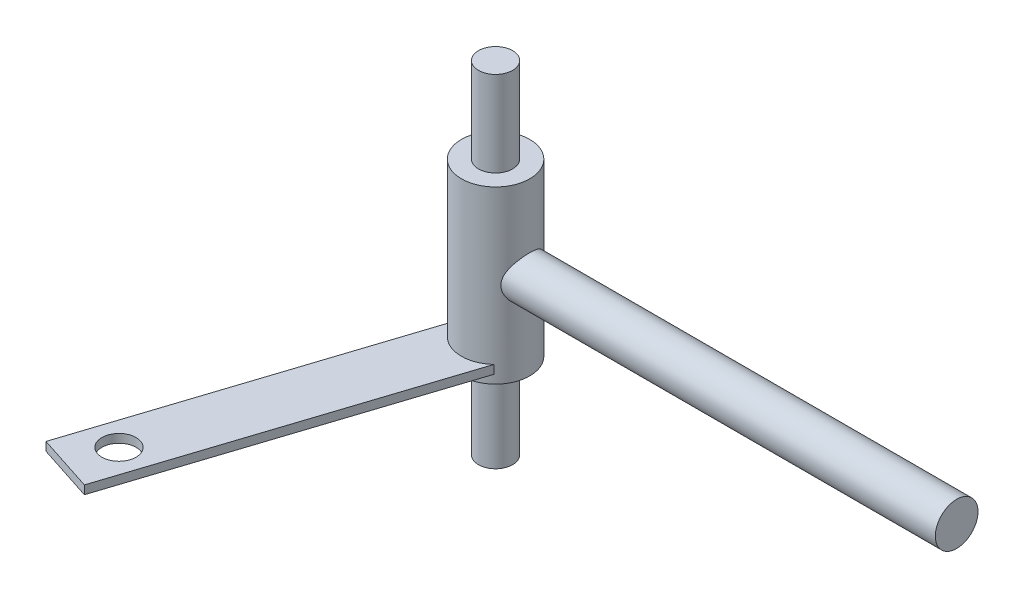
from build123d import *

# Parameters (mm, degrees)
SKETCH1_R           = 4
BOSS_EXTRUDE1_DEPTH = 40
SKETCH3_R           = 8
BOSS_EXTRUDE2_DEPTH = 20
SKETCH4_R           = 5
BOSS_EXTRUDE3_DEPTH = 108
SKETCH5_W           = 14
SKETCH5_H           = 2
BOSS_EXTRUDE4_DEPTH = 80
CUT_EXTRUDE1_REACH  = 146.647
SKETCH6_R           = 4


with BuildPart() as part:
    # Sketch1 → Boss-Extrude1 (new, symmetric)
    with BuildSketch(Plane(origin=(0, 0, 0), x_dir=(1, 0, 0), z_dir=(0, 1, 0))):
        Circle(SKETCH1_R)
    extrude(amount=BOSS_EXTRUDE1_DEPTH, both=True)

    # Sketch3 → Boss-Extrude2 (add, symmetric)
    with BuildSketch(Plane(origin=(0, 0, 0), x_dir=(1, 0, 0), z_dir=(0, 1, 0))):
        Circle(SKETCH3_R)
    extrude(amount=BOSS_EXTRUDE2_DEPTH, both=True)

    # Sketch4 → Boss-Extrude3 (add)
    with BuildSketch(Plane(origin=(0, 0, 0), x_dir=(0, 0, -1), z_dir=(1, 0, 0))):
        Circle(SKETCH4_R)
    extrude(amount=BOSS_EXTRUDE3_DEPTH)

    # Sketch5 → Boss-Extrude4 (add)
    with BuildSketch(Plane(origin=(0, 0, 0), x_dir=(0.9510565162951534, 0, 0.3090169943749482), z_dir=(-0.3090169943749482, 0, 0.9510565162951534))):
        with Locations((0, -17)):
            Rectangle(SKETCH5_W, SKETCH5_H)
    extrude(amount=BOSS_EXTRUDE4_DEPTH)

    # Sketch6 → Cut-Extrude1 (cut, up to next)
    with BuildSketch(Plane(origin=(0, -16, 0), x_dir=(1, 0, 0), z_dir=(0, 1, 0)), mode=Mode.PRIVATE) as cut_extrude1_sk1:
        with Locations((-21.631189606, -66.573956141)):
            Circle(SKETCH6_R)
    cut_extrude1_tool1 = extrude(cut_extrude1_sk1.sketch, amount=-CUT_EXTRUDE1_REACH, mode=Mode.PRIVATE) & part.part
    add(cut_extrude1_tool1.solids().sort_by_distance((-21.63119, -16, 66.573956))[0], mode=Mode.SUBTRACT)


solid = part.part
